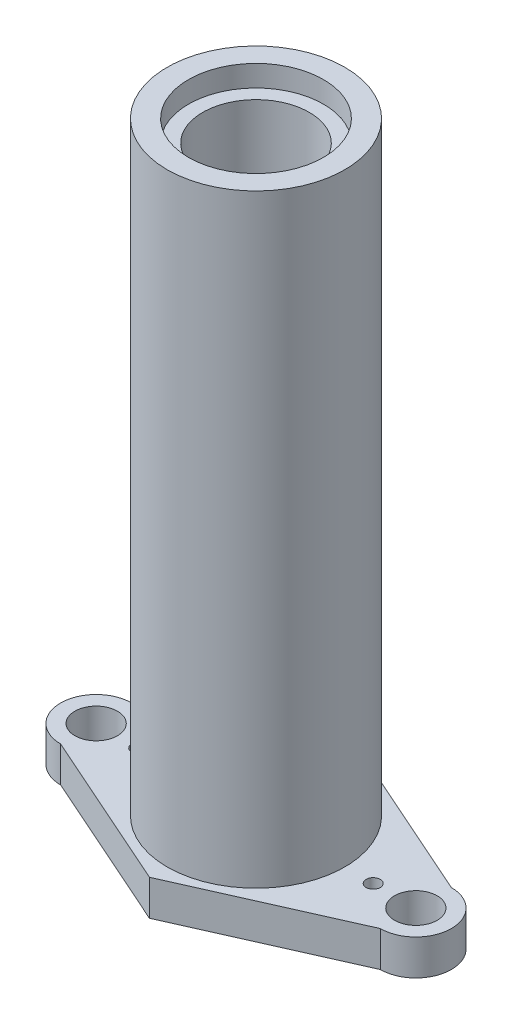
from build123d import *

# Parameters (mm, degrees)
SKETCH_1_R          = 3
SKETCH_1_R_2        = 10
SKETCH_1_R_3        = 1
EXTRUDE_1_DEPTH     = 5
SKETCH_2_R          = 12.5
SKETCH_2_R_2        = 10
EXTRUDE_2_DEPTH     = 70
SKETCH_3_R          = 12.5
EXTRUDE_3_DEPTH     = 15
SKETCH_4_R          = 4
CUT_EXTRUDE_1_DEPTH = 96.436281211
SKETCH_5_R          = 7.5
CUT_EXTRUDE_2_DEPTH = 12
SKETCH_6_R          = 9.5
CUT_EXTRUDE_3_DEPTH = 3


with BuildPart() as part:
    # Эскиз1 → Бобышка-Вытянуть1 (new body)
    with BuildSketch(Plane(origin=(0, 0, 0), x_dir=(1, 0, 0), z_dir=(0, 1, 0))):
        with BuildLine():
            Line((-22.5, 4.130728704), (0, 14.130728704))
            Line((0, 14.130728704), (22.5, 4.130728704))
            ThreePointArc((22.5, 4.130728704), (27.5, -0.869271296), (22.5, -5.869271296))
            Line((22.5, -5.869271296), (0, -15.869271296))
            Line((0, -15.869271296), (-22.5, -5.869271296))
            ThreePointArc((-22.5, -5.869271296), (-27.5, -0.869271296), (-22.5, 4.130728704))
        make_face()
        with Locations(Location((-22.5, -0.869271296, 0), (0, 0, 270))):
            Circle(SKETCH_1_R, mode=Mode.SUBTRACT)
        with Locations(Location((0, -0.869271296, 0), (0, 0, 270))):
            Circle(SKETCH_1_R_2, mode=Mode.SUBTRACT)
        with Locations(Location((22.5, -0.869271296, 0), (0, 0, 270))):
            Circle(SKETCH_1_R, mode=Mode.SUBTRACT)
        with Locations(Location((-16.5, -0.869271296, 0), (0, 0, 270))):
            Circle(SKETCH_1_R_3, mode=Mode.SUBTRACT)
        with Locations(Location((16.5, -0.869271296, 0), (0, 0, 270))):
            Circle(SKETCH_1_R_3, mode=Mode.SUBTRACT)
    extrude(amount=EXTRUDE_1_DEPTH)

    # Эскиз2 → Бобышка-Вытянуть2 (add)
    with BuildSketch(Plane(origin=(0, 5, 0), x_dir=(1, 0, 0), z_dir=(0, 1, 0))):
        with Locations(Location((0, -0.869271296, 0), (0, 0, 270))):
            Circle(SKETCH_2_R)
        with Locations(Location((0, -0.869271296, 0), (0, 0, 270))):
            Circle(SKETCH_2_R_2, mode=Mode.SUBTRACT)
    extrude(amount=EXTRUDE_2_DEPTH)

    # Эскиз3 → Бобышка-Вытянуть3 (add)
    with BuildSketch(Plane(origin=(0, 75, 0), x_dir=(1, 0, 0), z_dir=(0, 1, 0))):
        with Locations(Location((0, -0.869271296, 0), (0, 0, 270))):
            Circle(SKETCH_3_R)
    extrude(amount=EXTRUDE_3_DEPTH)

    # Эскиз4 → Вырез-Вытянуть1 (cut, through all)
    with BuildSketch(Plane(origin=(0, 90, 0), x_dir=(1, 0, 0), z_dir=(0, 1, 0))):
        with Locations(Location((0, -0.869271296, 0), (0, 0, 270))):
            Circle(SKETCH_4_R)
    extrude(amount=-CUT_EXTRUDE_1_DEPTH, mode=Mode.SUBTRACT)

    # Эскиз5 → Вырез-Вытянуть2 (cut)
    with BuildSketch(Plane(origin=(0, 90, 0), x_dir=(1, 0, 0), z_dir=(0, 1, 0))):
        with Locations(Location((0, -0.869271296, 0), (0, 0, 270))):
            Circle(SKETCH_5_R)
    extrude(amount=-CUT_EXTRUDE_2_DEPTH, mode=Mode.SUBTRACT)

    # Эскиз6 → Вырез-Вытянуть3 (cut)
    with BuildSketch(Plane(origin=(0, 90, 0), x_dir=(1, 0, 0), z_dir=(0, 1, 0))):
        with Locations(Location((0, -0.869271296, 0), (0, 0, 270))):
            Circle(SKETCH_6_R)
    extrude(amount=-CUT_EXTRUDE_3_DEPTH, mode=Mode.SUBTRACT)


solid = part.part
